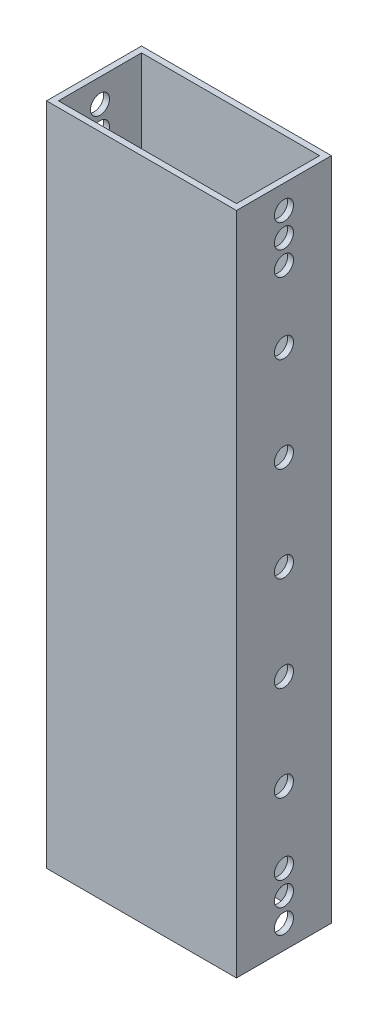
from build123d import *

# Parameters (mm, degrees)
SKETCH2_W           = 50.8
SKETCH2_H           = 25.4
SKETCH2_W_2         = 47.625
SKETCH2_H_2         = 22.225
BOSS_EXTRUDE2_DEPTH = 177.8
SKETCH4_R           = 2.5527
CUT_EXTRUDE2_DEPTH  = 50.8
LPATTERN1_COUNT     = 27
LPATTERN1_PITCH     = 6.35
SKETCH5_R           = 2.5527
CUT_EXTRUDE3_DEPTH  = 50.8
LPATTERN2_COUNT     = 5
LPATTERN2_PITCH     = 25.4


with BuildPart() as part:
    # Sketch2 → Boss-Extrude2 (new body)
    with BuildSketch(Plane(origin=(0, 0, 0), x_dir=(1, 0, 0), z_dir=(0, 1, 0))):
        with Locations((25.4, 12.7)):
            Rectangle(SKETCH2_W, SKETCH2_H)
        with Locations((25.4, 12.7)):
            Rectangle(SKETCH2_W_2, SKETCH2_H_2, mode=Mode.SUBTRACT)
    extrude(amount=BOSS_EXTRUDE2_DEPTH)

    # Sketch4 → Cut-Extrude2 (cut)
    with BuildSketch(Plane.ZY):
        with Locations((-12.7, 171.45)):
            Circle(SKETCH4_R)
    cut_extrude2 = extrude(amount=-CUT_EXTRUDE2_DEPTH, mode=Mode.SUBTRACT)

    # LPattern1: Cut-Extrude2 ×27, 21 skipped
    with Locations(*[(0, -i * LPATTERN1_PITCH, 0) for i in range(1, LPATTERN1_COUNT) if i not in (3, 4, 5, 6, 7, 8, 9, 10, 11, 12, 13, 14, 15, 16, 17, 18, 19, 20, 21, 22, 23)]):
        add(cut_extrude2, mode=Mode.SUBTRACT)

    # Sketch5 → Cut-Extrude3 (cut)
    with BuildSketch(Plane.ZY):
        with Locations((-12.7, 139.7)):
            Circle(SKETCH5_R)
    cut_extrude3 = extrude(amount=-CUT_EXTRUDE3_DEPTH, mode=Mode.SUBTRACT)

    # LPattern2: Cut-Extrude3 ×5
    with Locations(*[(0, -i * LPATTERN2_PITCH, 0) for i in range(1, LPATTERN2_COUNT)]):
        add(cut_extrude3, mode=Mode.SUBTRACT)


solid = part.part
